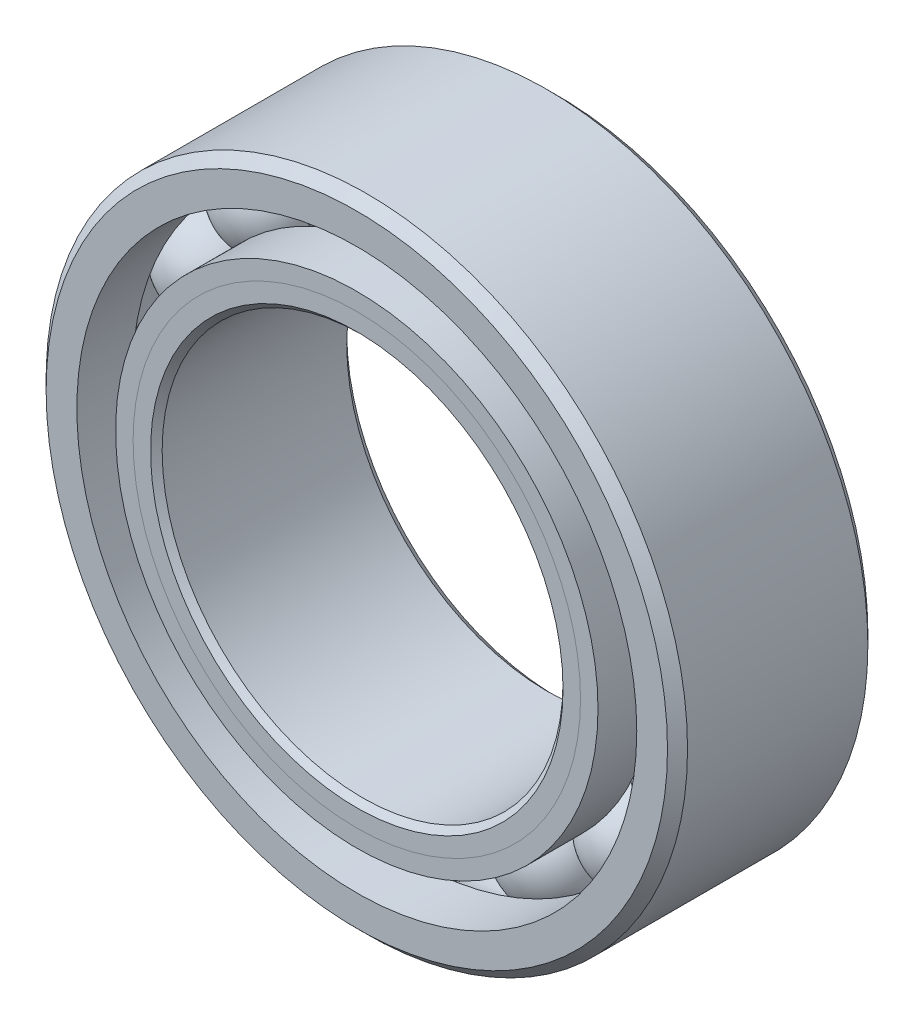
from build123d import *

# Parameters (mm, degrees)
CIRPATTERN1_COUNT = 16


with BuildPart() as part:
    # Sketch1 → Revolve1 (revolve)
    with BuildSketch(Plane(origin=(0, 0, 0), x_dir=(0, 0, -1), z_dir=(1, 0, 0))):
        with BuildLine():
            Line((1.785366, 6.35), (-1.785366, 6.35))
            Line((-1.785366, 6.35), (-1.98374, 6.151626))
            Line((-1.98374, 6.151626), (-1.98374, 5.543222033))
            Line((-1.98374, 5.543222033), (-0.881662222, 5.543222033))
            ThreePointArc((-0.881662222, 5.543222033), (0, 6.120970975), (0.881662222, 5.543222033))
            Line((0.881662222, 5.543222033), (1.98374, 5.543222033))
            Line((1.98374, 5.543222033), (1.98374, 6.151626))
            Line((1.98374, 6.151626), (1.785366, 6.35))
        make_face()
    revolve(axis=Axis((0, 0, 1.98374), (0, 0, -1)))


with BuildPart() as body_2:
    # Sketch2 → Revolve2 (revolve)
    with BuildSketch(Plane(origin=(0, 0, 0), x_dir=(0, 0, -1), z_dir=(1, 0, 0))):
        with BuildLine():
            Line((-1.98374, 4.775527967), (-0.881662222, 4.775527967))
            ThreePointArc((-0.881662222, 4.775527967), (-0.527048886, 4.355082584), (0, 4.197779025))
            Line((0, 4.197779025), (0, 4.083264513))
            Line((0, 4.083264513), (-1.637608273, 4.083264513))
            Line((-1.637608273, 4.083264513), (-1.98374, 4.42939624))
            Line((-1.98374, 4.42939624), (-1.98374, 4.775527967))
        make_face()
    revolve(axis=Axis((0, 0, 1.98374), (0, 0, -1)))


with BuildPart() as body_3:
    # Sketch3 → Revolve3 (revolve)
    with BuildSketch(Plane(origin=(0, 0, 0), x_dir=(0, 0, -1), z_dir=(1, 0, 0))):
        with BuildLine():
            Line((-1.98374, 4.42939624), (-1.637608273, 4.083264513))
            Line((-1.637608273, 4.083264513), (0, 4.083264513))
            Line((0, 4.083264513), (0, 4.197779025))
            ThreePointArc((0, 4.197779025), (0.527048886, 4.355082584), (0.881662222, 4.775527967))
            Line((0.881662222, 4.775527967), (1.98374, 4.775527967))
            Line((1.98374, 4.775527967), (1.98374, 4.167124))
            Line((1.98374, 4.167124), (1.785366, 3.96875))
            Line((1.785366, 3.96875), (-1.869225487, 3.96875))
            Line((-1.869225487, 3.96875), (-1.98374, 4.083264513))
            Line((-1.98374, 4.083264513), (-1.98374, 4.42939624))
        make_face()
    revolve(axis=Axis((0, 0, 1.98374), (0, 0, -1)))


with BuildPart() as body_4:
    # Sketch4 → Revolve4 (revolve)
    with BuildSketch(Plane(origin=(0, 0, 0), x_dir=(0, 0, -1), z_dir=(1, 0, 0))):
        with BuildLine():
            Line((-0.961595975, 5.159375), (0.961595975, 5.159375))
            ThreePointArc((0.961595975, 5.159375), (0, 6.120970975), (-0.961595975, 5.159375))
        make_face()
    revolve(axis=Axis((0, 5.159375, 0.961595975), (0, 0, -1)))


with BuildPart() as cirpattern1_1:
    # CirPattern1: pattern copy
    add(body_4.part.rotate(Axis((0, 0, -1.98374), (0, 0, 1)), 1 * 360 / CIRPATTERN1_COUNT))


with BuildPart() as cirpattern1_2:
    # CirPattern1: pattern copy
    add(body_4.part.rotate(Axis((0, 0, -1.98374), (0, 0, 1)), 2 * 360 / CIRPATTERN1_COUNT))


with BuildPart() as cirpattern1_3:
    # CirPattern1: pattern copy
    add(body_4.part.rotate(Axis((0, 0, -1.98374), (0, 0, 1)), 3 * 360 / CIRPATTERN1_COUNT))


with BuildPart() as cirpattern1_4:
    # CirPattern1: pattern copy
    add(body_4.part.rotate(Axis((0, 0, -1.98374), (0, 0, 1)), 4 * 360 / CIRPATTERN1_COUNT))


with BuildPart() as cirpattern1_5:
    # CirPattern1: pattern copy
    add(body_4.part.rotate(Axis((0, 0, -1.98374), (0, 0, 1)), 5 * 360 / CIRPATTERN1_COUNT))


with BuildPart() as cirpattern1_6:
    # CirPattern1: pattern copy
    add(body_4.part.rotate(Axis((0, 0, -1.98374), (0, 0, 1)), 6 * 360 / CIRPATTERN1_COUNT))


with BuildPart() as cirpattern1_7:
    # CirPattern1: pattern copy
    add(body_4.part.rotate(Axis((0, 0, -1.98374), (0, 0, 1)), 7 * 360 / CIRPATTERN1_COUNT))


with BuildPart() as cirpattern1_8:
    # CirPattern1: pattern copy
    add(body_4.part.rotate(Axis((0, 0, -1.98374), (0, 0, 1)), 8 * 360 / CIRPATTERN1_COUNT))


with BuildPart() as cirpattern1_9:
    # CirPattern1: pattern copy
    add(body_4.part.rotate(Axis((0, 0, -1.98374), (0, 0, 1)), 9 * 360 / CIRPATTERN1_COUNT))


with BuildPart() as cirpattern1_10:
    # CirPattern1: pattern copy
    add(body_4.part.rotate(Axis((0, 0, -1.98374), (0, 0, 1)), 10 * 360 / CIRPATTERN1_COUNT))


with BuildPart() as cirpattern1_11:
    # CirPattern1: pattern copy
    add(body_4.part.rotate(Axis((0, 0, -1.98374), (0, 0, 1)), 11 * 360 / CIRPATTERN1_COUNT))


with BuildPart() as cirpattern1_12:
    # CirPattern1: pattern copy
    add(body_4.part.rotate(Axis((0, 0, -1.98374), (0, 0, 1)), 12 * 360 / CIRPATTERN1_COUNT))


with BuildPart() as cirpattern1_13:
    # CirPattern1: pattern copy
    add(body_4.part.rotate(Axis((0, 0, -1.98374), (0, 0, 1)), 13 * 360 / CIRPATTERN1_COUNT))


with BuildPart() as cirpattern1_14:
    # CirPattern1: pattern copy
    add(body_4.part.rotate(Axis((0, 0, -1.98374), (0, 0, 1)), 14 * 360 / CIRPATTERN1_COUNT))


with BuildPart() as cirpattern1_15:
    # CirPattern1: pattern copy
    add(body_4.part.rotate(Axis((0, 0, -1.98374), (0, 0, 1)), 15 * 360 / CIRPATTERN1_COUNT))


solid = Compound([part.part, body_2.part, body_3.part, body_4.part, cirpattern1_1.part, cirpattern1_2.part, cirpattern1_3.part, cirpattern1_4.part, cirpattern1_5.part, cirpattern1_6.part, cirpattern1_7.part, cirpattern1_8.part, cirpattern1_9.part, cirpattern1_10.part, cirpattern1_11.part, cirpattern1_12.part, cirpattern1_13.part, cirpattern1_14.part, cirpattern1_15.part])
